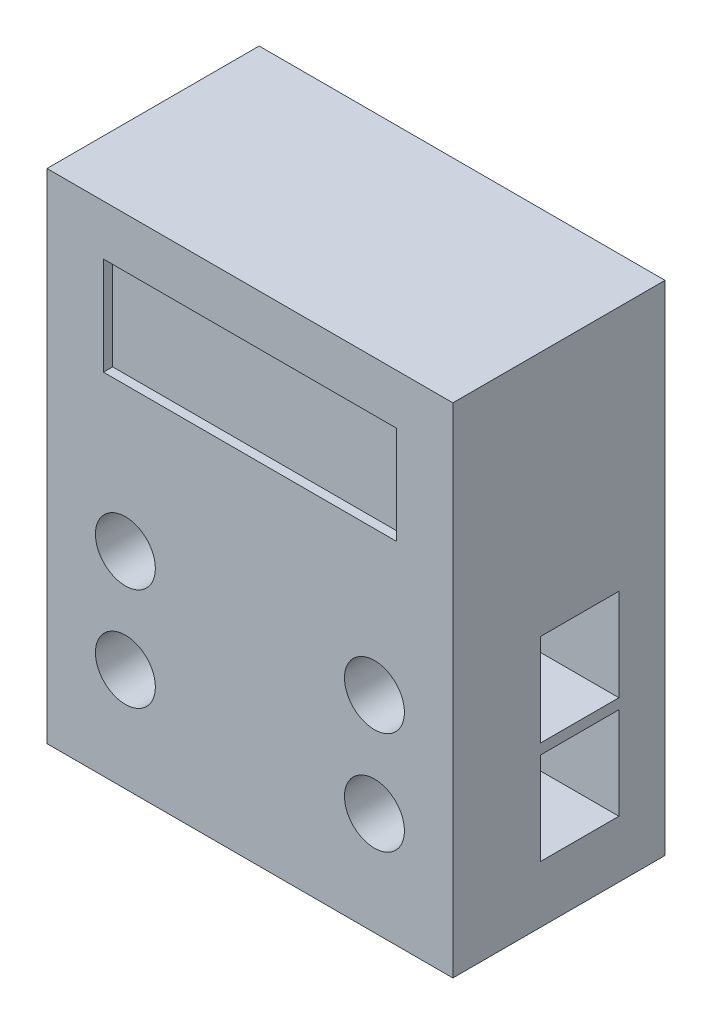
from build123d import *

# Parameters (mm, degrees)
SKETCH2_W           = 87.999717
SKETCH2_H           = 108
SKETCH2_R           = 6.5
SKETCH2_W_2         = 63.5
SKETCH2_H_2         = 21.25
BOSS_EXTRUDE1_DEPTH = 46
SKETCH4_W           = 63.5
SKETCH4_H           = 21.25
BOSS_EXTRUDE2_DEPTH = 44
BOSS_EXTRUDE3_START = -10
SKETCH5_R           = 6.5
BOSS_EXTRUDE3_DEPTH = 10
CUT_EXTRUDE1_START  = 43.999859
SKETCH3_W           = 2
SKETCH3_H           = 20
CUT_EXTRUDE1_DEPTH  = 27
CUT_EXTRUDE2_START  = -43.999859
SKETCH3_3_W         = 2
SKETCH3_3_H         = 20
CUT_EXTRUDE2_DEPTH  = 27


with BuildPart() as part:
    # Sketch2 → Boss-Extrude1 (new body)
    with BuildSketch(Plane.XY):
        Rectangle(SKETCH2_W, SKETCH2_H)
        with Locations((-27, -9.375)):
            Circle(SKETCH2_R, mode=Mode.SUBTRACT)
        with Locations((27, -9.375)):
            Circle(SKETCH2_R, mode=Mode.SUBTRACT)
        with Locations((27, -31.625)):
            Circle(SKETCH2_R, mode=Mode.SUBTRACT)
        with Locations((-27, -31.625)):
            Circle(SKETCH2_R, mode=Mode.SUBTRACT)
        with Locations((0, 32.5)):
            Rectangle(SKETCH2_W_2, SKETCH2_H_2, mode=Mode.SUBTRACT)
    extrude(amount=-BOSS_EXTRUDE1_DEPTH)

    # Sketch4 → Boss-Extrude2 (add)
    with BuildSketch(Plane(origin=(0, 0, -46), x_dir=(-1, 0, 0), z_dir=(0, 0, -1))):
        with Locations((0, 32.5)):
            Rectangle(SKETCH4_W, SKETCH4_H)
    extrude(amount=-BOSS_EXTRUDE2_DEPTH)

    # Sketch5 → Boss-Extrude3 (add)
    with BuildSketch(Plane(origin=(0, 0, -46), x_dir=(-1, 0, 0), z_dir=(0, 0, -1)).offset(BOSS_EXTRUDE3_START)):
        with Locations(Location((-27, -9.375, 0), (0, 0, 180))):
            Circle(SKETCH5_R)
        with Locations(Location((-27, -31.625, 0), (0, 0, 180))):
            Circle(SKETCH5_R)
        with Locations(Location((27, -31.625, 0), (0, 0, 180))):
            Circle(SKETCH5_R)
        with Locations(Location((27, -9.375, 0), (0, 0, 180))):
            Circle(SKETCH5_R)
    extrude(amount=BOSS_EXTRUDE3_DEPTH)

    # Sketch3 → Cut-Extrude1 (cut)
    with BuildSketch(Plane(origin=(0, 0, 0), x_dir=(0, 0, -1), z_dir=(1, 0, 0)).offset(CUT_EXTRUDE1_START)):
        with BuildLine():
            Line((34, -1.125), (34, 0.625))
            Line((34, 0.625), (19, 0.625))
            Line((19, 0.625), (19, -19.375))
            Line((19, -19.375), (34, -19.375))
            Line((34, -19.375), (34, -17.625))
            ThreePointArc((34, -17.625), (27.5, -9.375), (34, -1.125))
        make_face()
        with Locations((35, -9.375)):
            Rectangle(SKETCH3_W, SKETCH3_H)
        with BuildLine():
            Line((34, -21.625), (19, -21.625))
            Line((19, -21.625), (19, -41.625))
            Line((19, -41.625), (34, -41.625))
            Line((34, -41.625), (34, -39.875))
            ThreePointArc((34, -39.875), (27.5, -31.625), (34, -23.375))
            Line((34, -23.375), (34, -21.625))
        make_face()
        with BuildLine():
            Line((34, -39.875), (34, -23.375))
            ThreePointArc((34, -23.375), (27.5, -31.625), (34, -39.875))
        make_face()
        with Locations((35, -31.625)):
            Rectangle(SKETCH3_W, SKETCH3_H)
        with BuildLine():
            Line((34, -17.625), (34, -1.125))
            ThreePointArc((34, -1.125), (27.5, -9.375), (34, -17.625))
        make_face()
    extrude(amount=-CUT_EXTRUDE1_DEPTH, mode=Mode.SUBTRACT)

    # Sketch3<3> → Cut-Extrude2 (cut)
    with BuildSketch(Plane(origin=(0, 0, 0), x_dir=(0, 0, -1), z_dir=(1, 0, 0)).offset(CUT_EXTRUDE2_START)):
        with BuildLine():
            Line((34, -1.125), (34, 0.625))
            Line((34, 0.625), (19, 0.625))
            Line((19, 0.625), (19, -19.375))
            Line((19, -19.375), (34, -19.375))
            Line((34, -19.375), (34, -17.625))
            ThreePointArc((34, -17.625), (27.5, -9.375), (34, -1.125))
        make_face()
        with BuildLine():
            Line((34, -17.625), (34, -1.125))
            ThreePointArc((34, -1.125), (27.5, -9.375), (34, -17.625))
        make_face()
        with Locations((35, -9.375)):
            Rectangle(SKETCH3_3_W, SKETCH3_3_H)
        with Locations((35, -31.625)):
            Rectangle(SKETCH3_3_W, SKETCH3_3_H)
        with BuildLine():
            Line((34, -39.875), (34, -23.375))
            ThreePointArc((34, -23.375), (27.5, -31.625), (34, -39.875))
        make_face()
        with BuildLine():
            Line((34, -21.625), (19, -21.625))
            Line((19, -21.625), (19, -41.625))
            Line((19, -41.625), (34, -41.625))
            Line((34, -41.625), (34, -39.875))
            ThreePointArc((34, -39.875), (27.5, -31.625), (34, -23.375))
            Line((34, -23.375), (34, -21.625))
        make_face()
    extrude(amount=CUT_EXTRUDE2_DEPTH, mode=Mode.SUBTRACT)


solid = part.part
